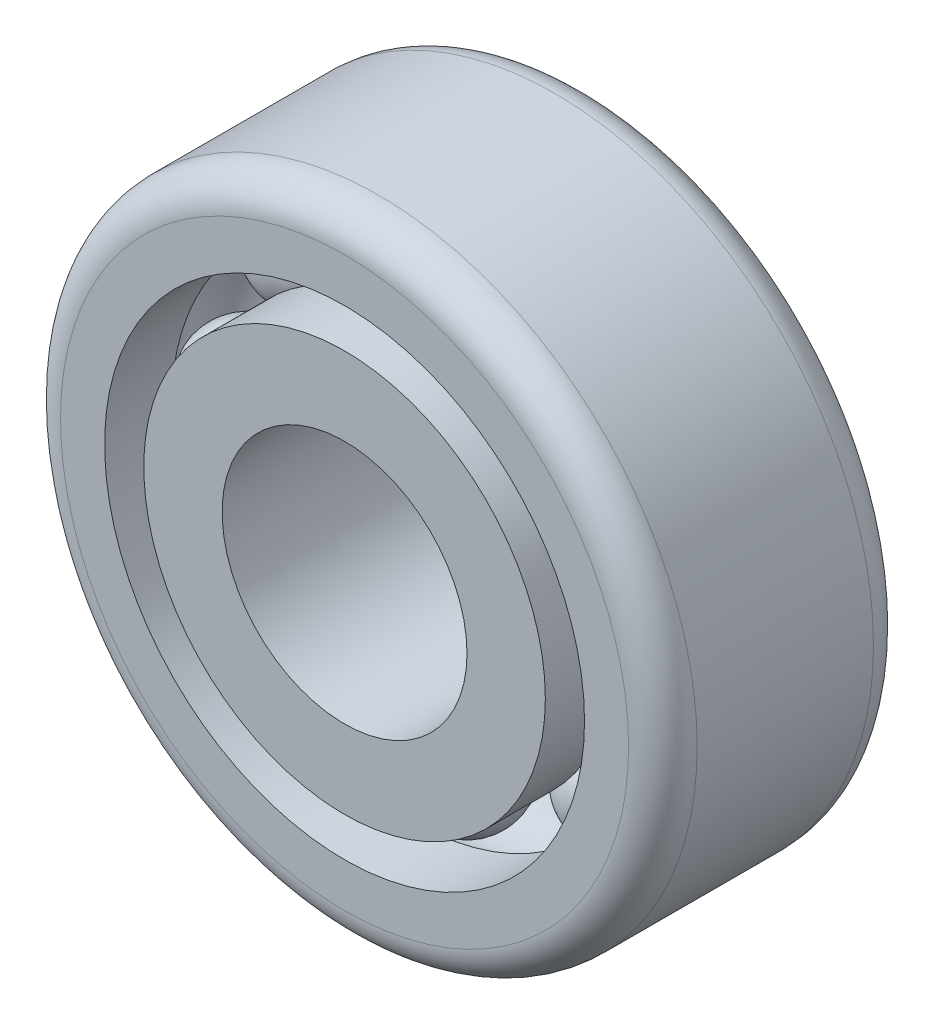
from build123d import *

# Parameters (mm, degrees)
MATRIZC4_COUNT = 8
REDONDEO1_R    = 0.7


with BuildPart() as part:
    # Croquis3 → Revolución4 (revolve)
    with BuildSketch(Plane(origin=(0, 0, 0), x_dir=(1, 0, 0), z_dir=(0, 1, 0)), mode=Mode.PRIVATE) as revoluci_n4_sk:
        with BuildLine():
            Line((-4.9, 2.5), (-6.5, 2.5))
            Line((-6.5, 2.5), (-6.5, -2.5))
            Line((-6.5, -2.5), (-4.9, -2.5))
            Line((-4.9, -2.5), (-4.9, -1.13137085))
            ThreePointArc((-4.9, -1.13137085), (-5.7, 0), (-4.9, 1.13137085))
            Line((-4.9, 1.13137085), (-4.9, 2.5))
        make_face()
        with BuildLine():
            Line((-4.1, 2.5), (-2.5, 2.5))
            Line((-2.5, 2.5), (-2.5, -2.5))
            Line((-2.5, -2.5), (-4.1, -2.5))
            Line((-4.1, -2.5), (-4.1, -1.13137085))
            ThreePointArc((-4.1, -1.13137085), (-3.3, 0), (-4.1, 1.13137085))
            Line((-4.1, 1.13137085), (-4.1, 2.5))
        make_face()
    revolve(revoluci_n4_sk.sketch.rotate(Axis((0, 0, 0), (0, 0, -1)), 180), axis=Axis((0, 0, 0), (0, 0, -1)))

    # Redondeo1
    redondeo1_edges = [part.edges().sort_by_distance(p)[0] for p in [
        (-6.5, 0, -2.5),
        (-6.5, 0, 2.5),
    ]]
    fillet(redondeo1_edges, radius=REDONDEO1_R)


with BuildPart() as body_2:
    # Croquis4 → Revolución3 (revolve)
    with BuildSketch(Plane(origin=(0, 0, 0), x_dir=(1, 0, 0), z_dir=(0, 1, 0))):
        with BuildLine():
            Line((-4.5, 1.061164853), (-4.5, -1.066714374))
            ThreePointArc((-4.5, -1.066714374), (-3.436060387, -0.002774761), (-4.5, 1.061164853))
        make_face()
    revolve(axis=Axis((-4.5, 0, -1.061164853), (0, 0, 1)))


with BuildPart() as matrizc4_1:
    # MatrizC4: pattern copy
    add(body_2.part.rotate(Axis((0, 0, 0), (0, 0, 1)), 1 * 360 / MATRIZC4_COUNT))


with BuildPart() as matrizc4_2:
    # MatrizC4: pattern copy
    add(body_2.part.rotate(Axis((0, 0, 0), (0, 0, 1)), 2 * 360 / MATRIZC4_COUNT))


with BuildPart() as matrizc4_3:
    # MatrizC4: pattern copy
    add(body_2.part.rotate(Axis((0, 0, 0), (0, 0, 1)), 3 * 360 / MATRIZC4_COUNT))


with BuildPart() as matrizc4_4:
    # MatrizC4: pattern copy
    add(body_2.part.rotate(Axis((0, 0, 0), (0, 0, 1)), 4 * 360 / MATRIZC4_COUNT))


with BuildPart() as matrizc4_5:
    # MatrizC4: pattern copy
    add(body_2.part.rotate(Axis((0, 0, 0), (0, 0, 1)), 5 * 360 / MATRIZC4_COUNT))


with BuildPart() as matrizc4_6:
    # MatrizC4: pattern copy
    add(body_2.part.rotate(Axis((0, 0, 0), (0, 0, 1)), 6 * 360 / MATRIZC4_COUNT))


with BuildPart() as matrizc4_7:
    # MatrizC4: pattern copy
    add(body_2.part.rotate(Axis((0, 0, 0), (0, 0, 1)), 7 * 360 / MATRIZC4_COUNT))


solid = Compound([part.part, body_2.part, matrizc4_1.part, matrizc4_2.part, matrizc4_3.part, matrizc4_4.part, matrizc4_5.part, matrizc4_6.part, matrizc4_7.part])
